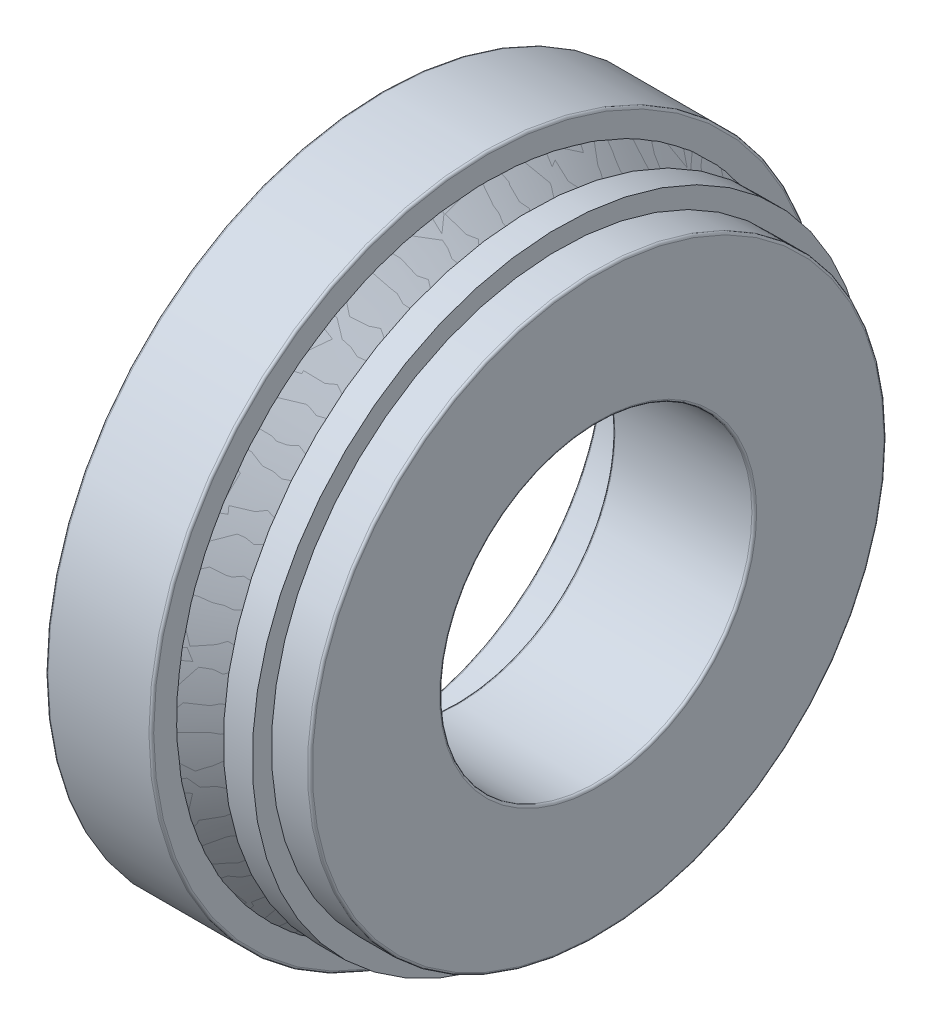
from build123d import *

# Parameters (mm, degrees)
VERRUNDUNG1_R = 0.5


with BuildPart() as part:
    # Skizze1 → Rotation1 (revolve)
    with BuildSketch(Plane.XY, mode=Mode.PRIVATE) as rotation1_sk:
        Polygon((-29.5, 32.5), (0, 32.5), (0, 60), (-8, 60), (-8, 64), (-14, 64), (-14, 55.740020558), (-23, 64.740020558), (-23, 70), (-45, 70), (-45, 45.75), (-36, 45.75), (-29.5, 39.25), align=None)
        with BuildLine():
            Line((-39.335543293, 49.086957506), (-26.163042494, 35.914456707))
            ThreePointArc((-26.163042494, 35.914456707), (-16.762159844, 42.388978407), (-8.205679758, 49.944286103))
            Line((-8.205679758, 49.944286103), (-25.305713897, 67.044320242))
            ThreePointArc((-25.305713897, 67.044320242), (-32.861021593, 58.487840156), (-39.335543293, 49.086957506))
        make_face(mode=Mode.SUBTRACT)
    revolve(rotation1_sk.sketch.rotate(Axis((0, 0, 0), (-1, 0, 0)), 90), axis=Axis((0, 0, 0), (-1, 0, 0)))

    # Verrundung1
    verrundung1_edges = [part.edges().sort_by_distance(p)[0] for p in [
        (-23, 0, 70),
        (-45, 0, 70),
        (-45, 0, 45.75),
        (-29.5, 0, 32.5),
        (0, 0, 32.5),
        (0, 0, 60),
    ]]
    fillet(verrundung1_edges, radius=VERRUNDUNG1_R)


solid = part.part
